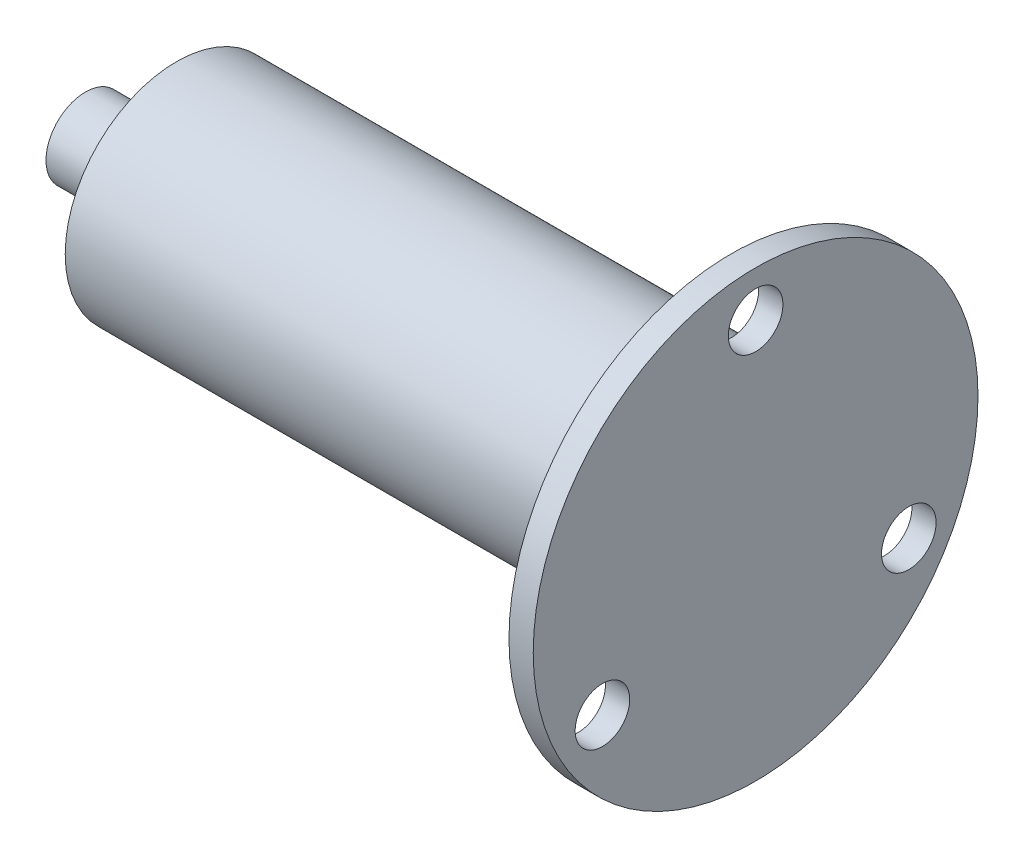
from build123d import *

# Parameters (mm, degrees)
SKETCH_2_R          = 2.7
CUT_EXTRUDE_1_DEPTH = 10


with BuildPart() as part:
    # 草图1 → 旋转1 (revolve)
    with BuildSketch(Plane.XY, mode=Mode.PRIVATE) as revolve_1_sk:
        Polygon((0, 0), (0, 3.9), (9, 3.9), (9, 11), (63.9, 11), (63.9, 22), (66.3, 22), (66.3, 11), (66.3, 0), align=None)
    revolve(revolve_1_sk.sketch.rotate(Axis((0, 0, 0), (1, 0, 0)), 90), axis=Axis((0, 0, 0), (1, 0, 0)))

    # 草图2 → 切除-拉伸1 (cut)
    with BuildSketch(Plane.ZY.offset(-63.9)):
        with Locations((0, 17.5)):
            Circle(SKETCH_2_R)
        with Locations((15.155444566, -8.75)):
            Circle(SKETCH_2_R)
        with Locations((-15.155444566, -8.75)):
            Circle(SKETCH_2_R)
    extrude(amount=-CUT_EXTRUDE_1_DEPTH, mode=Mode.SUBTRACT)


solid = part.part
